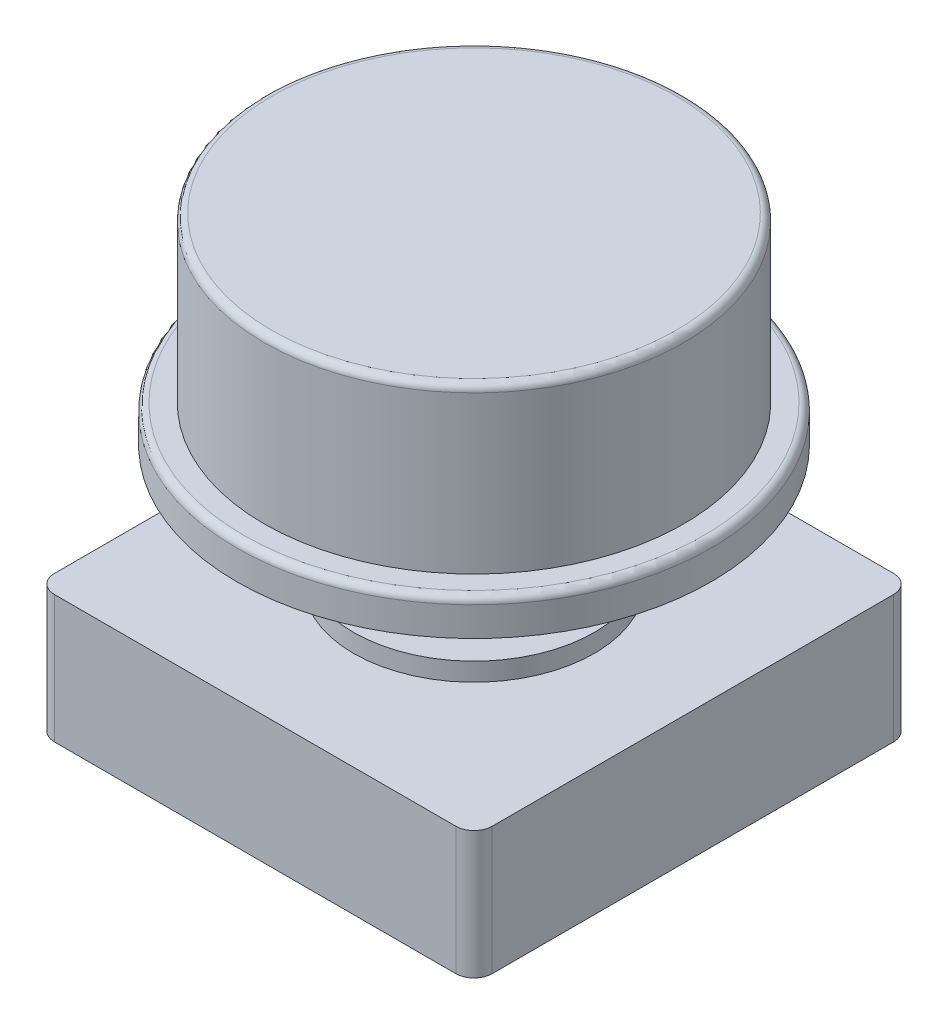
from build123d import *

# Parameters (mm, degrees)
BOSS_EXTRUDE1_DEPTH = 3.5
SKETCH2_R           = 3.3
BOSS_EXTRUDE2_DEPTH = 0.5
SKETCH3_W           = 3
SKETCH3_H           = 3
BOSS_EXTRUDE3_DEPTH = 2.8
SKETCH4_R           = 6.5
BOSS_EXTRUDE4_DEPTH = 1
SKETCH5_R           = 5.75
BOSS_EXTRUDE5_DEPTH = 4.5
FILLET1_R           = 0.2


with BuildPart() as part:
    # Sketch1 → Boss-Extrude1 (new body)
    with BuildSketch(Plane(origin=(0, 0, 0), x_dir=(1, 0, 0), z_dir=(0, 1, 0))):
        with BuildLine():
            Line((-0.5, 0), (-11.5, 0))
            ThreePointArc((-11.5, 0), (-11.853553391, 0.146446609), (-12, 0.5))
            Line((-12, 0.5), (-12, 11.5))
            ThreePointArc((-12, 11.5), (-11.853553391, 11.853553391), (-11.5, 12))
            Line((-11.5, 12), (-0.5, 12))
            ThreePointArc((-0.5, 12), (-0.146446609, 11.853553391), (0, 11.5))
            Line((0, 11.5), (0, 0.5))
            ThreePointArc((0, 0.5), (-0.146446609, 0.146446609), (-0.5, 0))
        make_face()
    extrude(amount=BOSS_EXTRUDE1_DEPTH)

    # Sketch2 → Boss-Extrude2 (add)
    with BuildSketch(Plane(origin=(0, 3.5, 0), x_dir=(1, 0, 0), z_dir=(0, 1, 0))):
        with Locations(Location((-6, 6, 0), (0, 0, 270))):
            Circle(SKETCH2_R)
    extrude(amount=BOSS_EXTRUDE2_DEPTH)

    # Sketch3 → Boss-Extrude3 (add)
    with BuildSketch(Plane(origin=(0, 4, 0), x_dir=(1, 0, 0), z_dir=(0, 1, 0))):
        with Locations((-6, 6)):
            Rectangle(SKETCH3_W, SKETCH3_H)
    extrude(amount=BOSS_EXTRUDE3_DEPTH)

    # Sketch4 → Boss-Extrude4 (add)
    with BuildSketch(Plane(origin=(0, 6.8, 0), x_dir=(1, 0, 0), z_dir=(0, 1, 0))):
        with Locations(Location((-6, 6, 0), (0, 0, 270))):
            Circle(SKETCH4_R)
    extrude(amount=BOSS_EXTRUDE4_DEPTH)

    # Sketch5 → Boss-Extrude5 (add)
    with BuildSketch(Plane(origin=(0, 7.8, 0), x_dir=(1, 0, 0), z_dir=(0, 1, 0))):
        with Locations(Location((-6, 6, 0), (0, 0, 270))):
            Circle(SKETCH5_R)
    extrude(amount=BOSS_EXTRUDE5_DEPTH)

    # Fillet1
    fillet1_edges = [part.edges().sort_by_distance(p)[0] for p in [
        (-6, 7.8, -12.5),
        (-6, 12.3, -11.75),
    ]]
    fillet(fillet1_edges, radius=FILLET1_R)


solid = part.part
